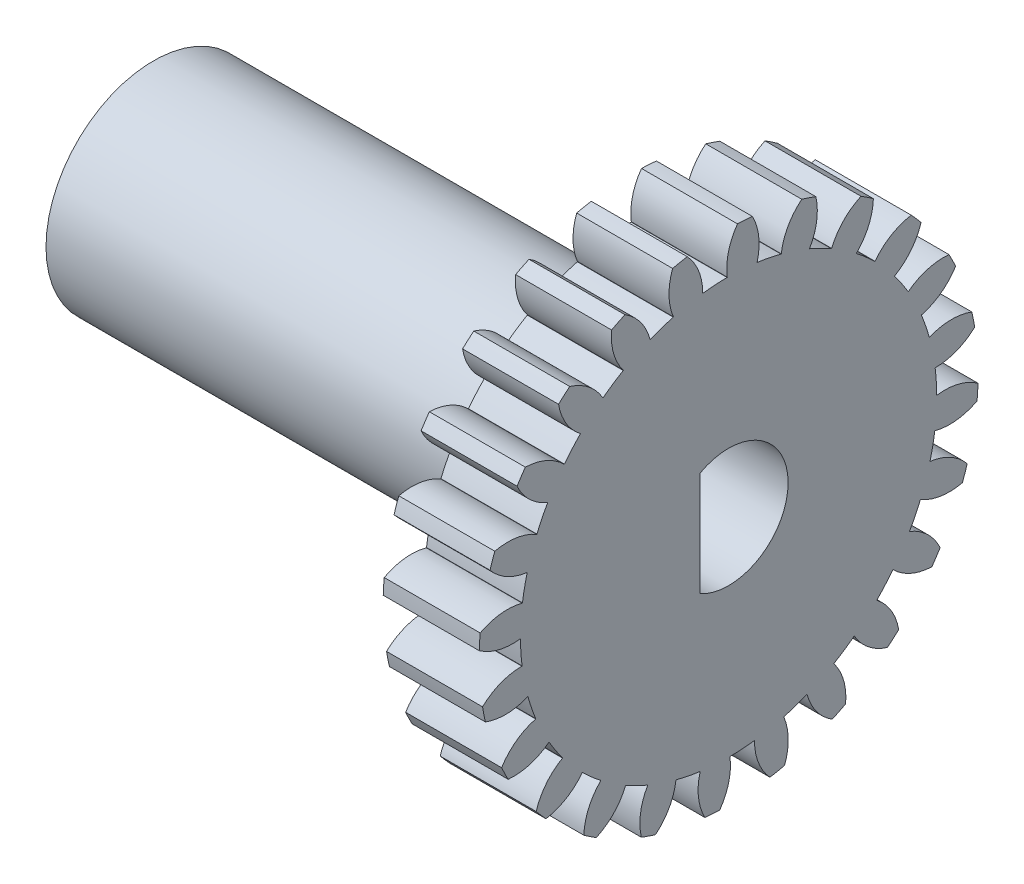
from build123d import *

# Parameters (mm, degrees)
SKETCH2_R                = 10.843
BOSS_EXTRUDE1_DEPTH      = 2.5
BOSS_EXTRUDE3_DEPTH      = 2.5
SKETCH5_R                = 38.4
SKETCH5_R_2              = 13
CUT_EXTRUDE1_DEPTH       = 18.467999614
FILLET1_R                = 0.01
CIRPATTERN2_COUNT        = 24
FILLET1_OF_CIRPATTERN2_R = 0.01
SKETCH8_R                = 5.6
BOSS_EXTRUDE4_DEPTH      = 24.96
SKETCH9_R                = 3.1
CUT_EXTRUDE3_DEPTH       = 36.145035133
BOSS_EXTRUDE5_START      = -5
BOSS_EXTRUDE5_DEPTH      = 24.96


with BuildPart() as part:
    # Sketch2 → Boss-Extrude1 (new, symmetric)
    with BuildSketch(Plane(origin=(0, 0, 0), x_dir=(0, 0, -1), z_dir=(1, 0, 0))):
        Circle(SKETCH2_R)
    extrude(amount=BOSS_EXTRUDE1_DEPTH, both=True)

    # Sketch4 → Boss-Extrude3 (add, symmetric)
    with BuildSketch(Plane(origin=(0, 0, 0), x_dir=(0, 0, -1), z_dir=(1, 0, 0))):
        with BuildLine():
            ThreePointArc((0.882552794, 13.465153601), (-0.089134073, 11.445068509), (0.610565863, 9.315434938))
            ThreePointArc((0.610565863, 9.315434938), (1.58225273, 11.33552003), (0.882552794, 13.465153601))
        make_face()
    boss_extrude3 = extrude(amount=BOSS_EXTRUDE3_DEPTH, both=True)

    # Sketch5 → Cut-Extrude1 (cut, symmetric)
    with BuildSketch(Plane(origin=(0, 0, 0), x_dir=(0, 0, -1), z_dir=(1, 0, 0))):
        Circle(SKETCH5_R)
        Circle(SKETCH5_R_2, mode=Mode.SUBTRACT)
    cut_extrude1 = extrude(amount=CUT_EXTRUDE1_DEPTH, both=True, mode=Mode.SUBTRACT)

    # Fillet1
    fillet1_edges = [part.edges().sort_by_distance(p)[0] for p in [
        (0, 10.8427871, 0.067947841),
        (0, 10.74115658, -1.482634251),
    ]]
    fillet(fillet1_edges, radius=FILLET1_R)

    # CirPattern2: Boss-Extrude3, Cut-Extrude1 ×24 about axis
    cirpattern2_axis = Axis((0, 0, 0), (1, 0, 0))
    add([boss_extrude3.rotate(cirpattern2_axis, i * 360 / CIRPATTERN2_COUNT) for i in range(1, CIRPATTERN2_COUNT)])
    add([cut_extrude1.rotate(cirpattern2_axis, i * 360 / CIRPATTERN2_COUNT) for i in range(1, CIRPATTERN2_COUNT)], mode=Mode.SUBTRACT)

    # Fillet1 of CirPattern2
    fillet1_of_cirpattern2_edges = [part.edges().sort_by_distance(p)[0] for p in [
        (0, 10.455741893, 2.871952378),
        (0, 10.758894526, 1.347901175),
        (0, 9.356155156, 5.480238107),
        (0, 10.04343159, 4.086579364),
        (0, 7.618961906, 7.715054665),
        (0, 8.643525389, 6.546763922),
        (0, 5.362548993, 9.424102997),
        (0, 6.654577216, 8.560797339),
        (0, 2.740687229, 10.490914284),
        (0, 4.212130604, 9.991426564),
        (0, -0.067947841, 10.8427871),
        (0, 1.482634251, 10.74115658),
        (0, -2.871952378, 10.455741893),
        (0, -1.347901175, 10.758894526),
        (0, -5.480238107, 9.356155156),
        (0, -4.086579364, 10.04343159),
        (0, -7.715054665, 7.618961906),
        (0, -6.546763922, 8.643525389),
        (0, -9.424102997, 5.362548993),
        (0, -8.560797339, 6.654577216),
        (0, -10.490914284, 2.740687229),
        (0, -9.991426564, 4.212130604),
        (0, -10.8427871, -0.067947841),
        (0, -10.74115658, 1.482634251),
        (0, -10.455741893, -2.871952378),
        (0, -10.758894526, -1.347901175),
        (0, -9.356155156, -5.480238107),
        (0, -10.04343159, -4.086579364),
        (0, -7.618961906, -7.715054665),
        (0, -8.643525389, -6.546763922),
        (0, -5.362548993, -9.424102997),
        (0, -6.654577216, -8.560797339),
        (0, -2.740687229, -10.490914284),
        (0, -4.212130604, -9.991426564),
        (0, 0.067947841, -10.8427871),
        (0, -1.482634251, -10.74115658),
        (0, 2.871952378, -10.455741893),
        (0, 1.347901175, -10.758894526),
        (0, 5.480238107, -9.356155156),
        (0, 4.086579364, -10.04343159),
        (0, 7.715054665, -7.618961906),
        (0, 6.546763922, -8.643525389),
        (0, 9.424102997, -5.362548993),
        (0, 8.560797339, -6.654577216),
        (0, 10.490914284, -2.740687229),
        (0, 9.991426564, -4.212130604),
    ]]
    fillet(fillet1_of_cirpattern2_edges, radius=FILLET1_OF_CIRPATTERN2_R)

    # Sketch8 → Boss-Extrude4 (add)
    with BuildSketch(Plane.ZY.offset(2.5)):
        with Locations(Location((0, 0, 0), (0, 0, 180))):
            Circle(SKETCH8_R)
    extrude(amount=BOSS_EXTRUDE4_DEPTH)

    # Sketch9 → Cut-Extrude3 (cut, through all)
    with BuildSketch(Plane.ZY.offset(27.46)):
        Circle(SKETCH9_R)
    extrude(amount=-CUT_EXTRUDE3_DEPTH, mode=Mode.SUBTRACT)

    # Sketch10 → Boss-Extrude5 (add, through all)
    with BuildSketch(Plane.ZY.offset(27.46).offset(BOSS_EXTRUDE5_START)):
        with BuildLine():
            Line((1.5, 2.712931993), (1.5, -2.712931993))
            ThreePointArc((1.5, -2.712931993), (3.1, 0), (1.5, 2.712931993))
        make_face()
    extrude(amount=-BOSS_EXTRUDE5_DEPTH)


solid = part.part
